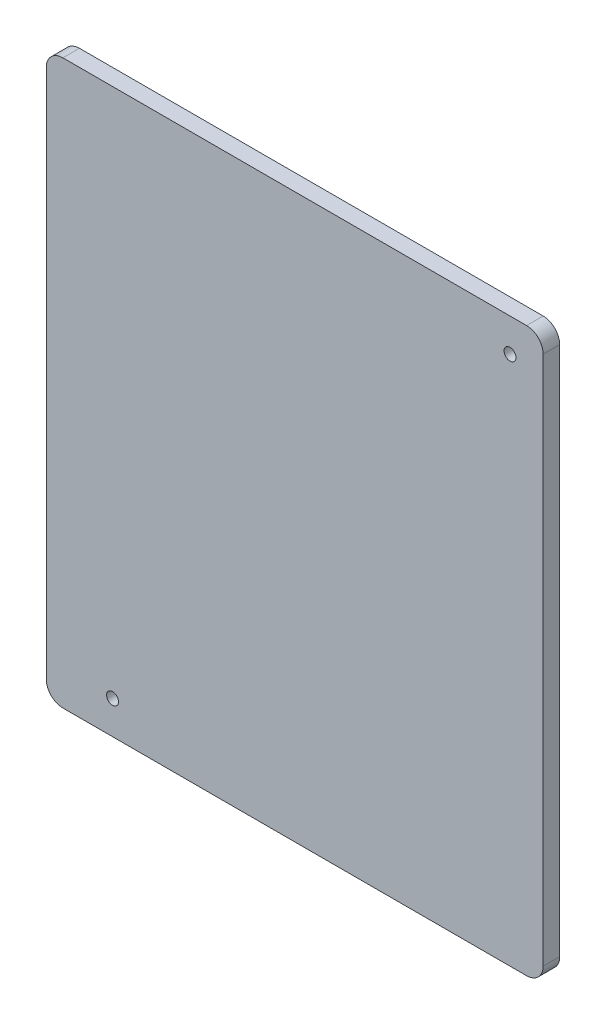
from build123d import *

# Parameters (mm, degrees)
RESSALTO_EXTRUS_O1_DEPTH    = 5
FURO_COM_FOLGA_DE_M31_D     = 3.6
FURO_COM_FOLGA_DE_M31_DEPTH = 15
FURO_COM_FOLGA_DE_M31_TIP   = 1.081549114


with BuildPart() as part:
    # Esboço1 → Ressalto-extrusão1 (new body)
    with BuildSketch(Plane.XY):
        with BuildLine():
            Line((0, -5), (140, -5))
            ThreePointArc((140, -5), (143.535533906, -3.535533906), (145, 0))
            Line((145, 0), (145, 160))
            ThreePointArc((145, 160), (143.535533906, 163.535533906), (140, 165))
            Line((140, 165), (0, 165))
            ThreePointArc((0, 165), (-3.535533906, 163.535533906), (-5, 160))
            Line((-5, 160), (-5, 0))
            ThreePointArc((-5, 0), (-3.535533906, -3.535533906), (0, -5))
        make_face()
    extrude(amount=RESSALTO_EXTRUS_O1_DEPTH)

    # Furo com folga de M31
    with Locations(Plane(origin=(135, 155, 0), x_dir=(-1, 0, 0), z_dir=(0, 0, -1))):
        with Locations((0, 0), (120, -150)):
            Hole(FURO_COM_FOLGA_DE_M31_D / 2, depth=FURO_COM_FOLGA_DE_M31_DEPTH)
            with Locations((0, 0, -(FURO_COM_FOLGA_DE_M31_DEPTH + FURO_COM_FOLGA_DE_M31_TIP / 2))):  # 118° drill point
                Cone(0, FURO_COM_FOLGA_DE_M31_D / 2, FURO_COM_FOLGA_DE_M31_TIP, mode=Mode.SUBTRACT)


solid = part.part
